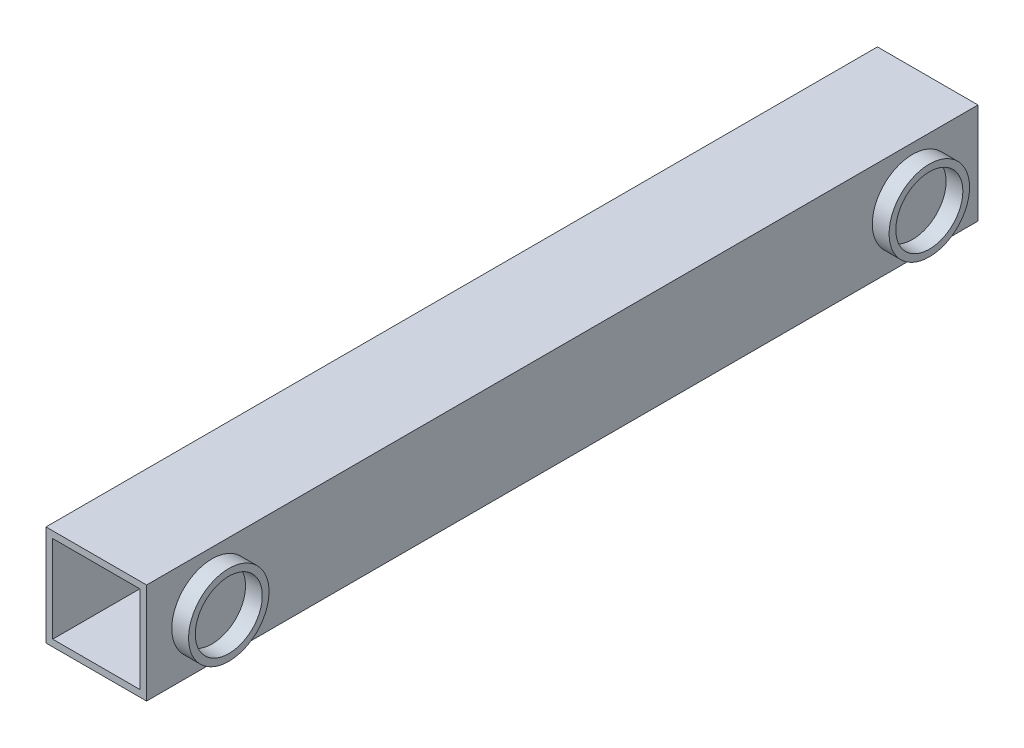
from build123d import *

# Parameters (mm, degrees)
SKETCH1_W           = 30
SKETCH1_H           = 30
SKETCH1_W_2         = 26
SKETCH1_H_2         = 26
BOSS_EXTRUDE1_DEPTH = 248
SKETCH2_R           = 12
SKETCH2_R_2         = 10
BOSS_EXTRUDE2_DEPTH = 5


with BuildPart() as part:
    # Sketch1 → Boss-Extrude1 (new body)
    with BuildSketch(Plane.XY):
        Rectangle(SKETCH1_W, SKETCH1_H)
        Rectangle(SKETCH1_W_2, SKETCH1_H_2, mode=Mode.SUBTRACT)
    extrude(amount=BOSS_EXTRUDE1_DEPTH)

    # Sketch2 → Boss-Extrude2 (add)
    # profile 1 of 2: a face of its own
    with BuildSketch(Plane(origin=(15, 0, 0), x_dir=(0, 0, -1), z_dir=(1, 0, 0))):
        with Locations(Location((-19.522331238, 0, 0), (0, 0, 180))):
            Circle(SKETCH2_R)
        with Locations((-19.522331238, 0)):
            Circle(SKETCH2_R_2, mode=Mode.SUBTRACT)
    # profile 2 of 2: a face of its own
    with BuildSketch(Plane(origin=(15, 0, 0), x_dir=(0, 0, -1), z_dir=(1, 0, 0))):
        with Locations(Location((-228.477668762, 0, 0), (0, 0, 180))):
            Circle(SKETCH2_R)
        with Locations(Location((-228.477668762, 0, 0), (0, 0, 180))):
            Circle(SKETCH2_R_2, mode=Mode.SUBTRACT)
    extrude(amount=BOSS_EXTRUDE2_DEPTH)


solid = part.part
